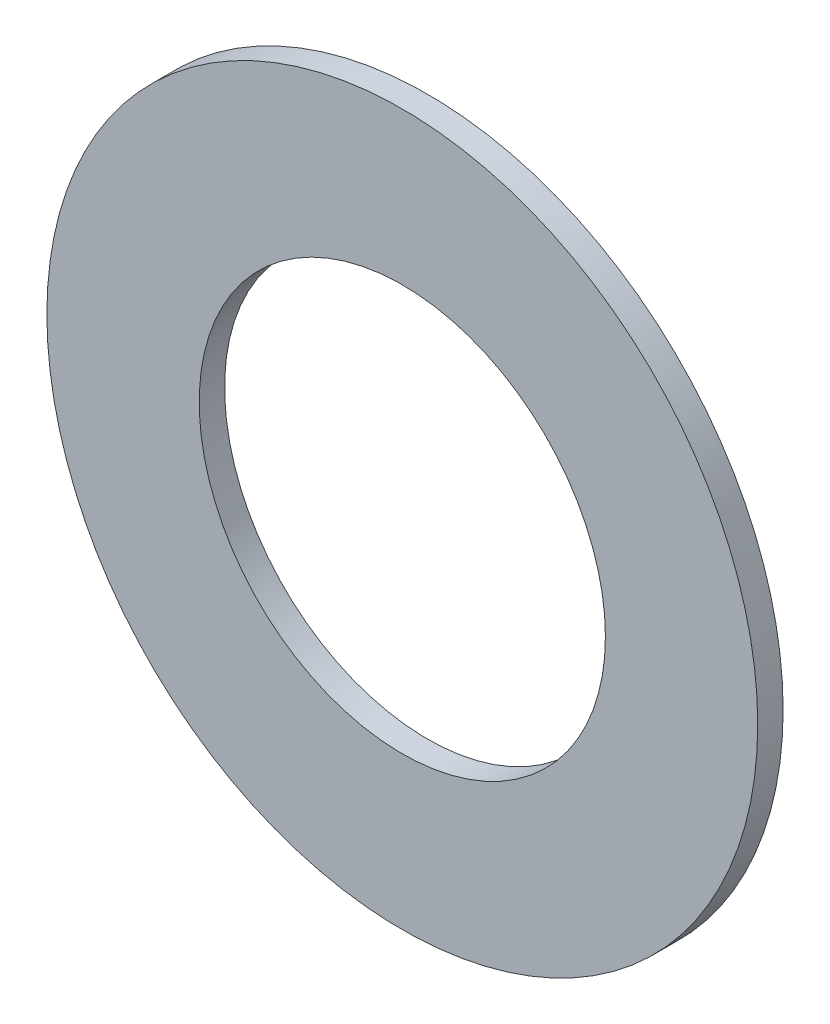
from build123d import *

# Parameters (mm, degrees)
SKETCH1_R           = 14
BOSS_EXTRUDE1_DEPTH = 1
SKETCH2_R           = 8
CUT_EXTRUDE1_DEPTH  = 1


with BuildPart() as part:
    # Sketch1 → Boss-Extrude1 (new body)
    with BuildSketch(Plane.XY):
        Circle(SKETCH1_R)
    extrude(amount=BOSS_EXTRUDE1_DEPTH)

    # Sketch2 → Cut-Extrude1 (cut)
    with BuildSketch(Plane.XY.offset(1)):
        Circle(SKETCH2_R)
    extrude(amount=-CUT_EXTRUDE1_DEPTH, mode=Mode.SUBTRACT)


solid = part.part
